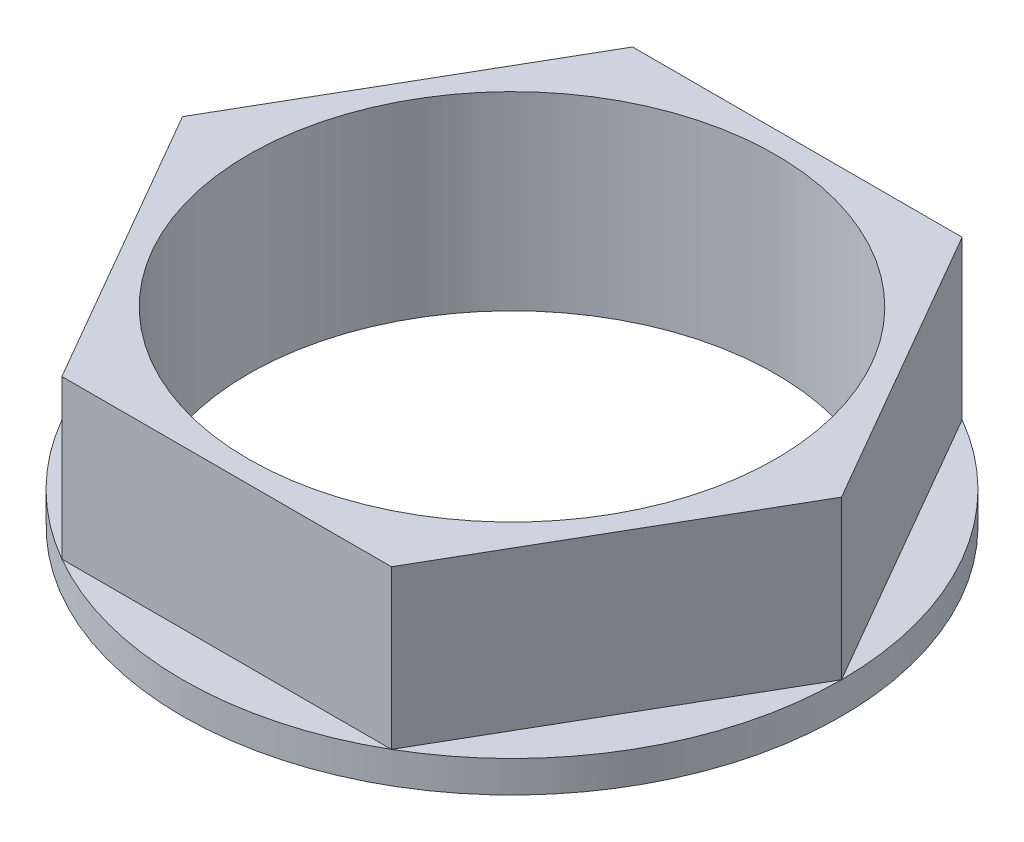
from build123d import *

# Parameters (mm, degrees)
SKETCH1_R           = 7.9375
BOSS_EXTRUDE1_DEPTH = 0.381
BOSS_EXTRUDE2_DEPTH = 3.81
SKETCH3_R           = 6.35
CUT_EXTRUDE1_DEPTH  = 13.120684655


with BuildPart() as part:
    # Sketch1 → Boss-Extrude1 (new, symmetric)
    with BuildSketch(Plane(origin=(0, 0, 0), x_dir=(1, 0, 0), z_dir=(0, 1, 0))):
        with Locations(Location((0, 0, 0), (0, 0, 90))):
            Circle(SKETCH1_R)
    extrude(amount=BOSS_EXTRUDE1_DEPTH, both=True)

    # Sketch2 → Boss-Extrude2 (add)
    with BuildSketch(Plane(origin=(0, 0.381, 0), x_dir=(1, 0, 0), z_dir=(0, 1, 0))):
        Polygon((-3.96875, -6.874076643), (3.96875, -6.874076643), (7.9375, 0), (3.96875, 6.874076643), (-3.96875, 6.874076643), (-7.9375, 0), align=None)
    extrude(amount=BOSS_EXTRUDE2_DEPTH)

    # Sketch3 → Cut-Extrude1 (cut, through all)
    with BuildSketch(Plane(origin=(0, 4.191, 0), x_dir=(1, 0, 0), z_dir=(0, 1, 0))):
        with Locations(Location((0, 0, 0), (0, 0, 270))):
            Circle(SKETCH3_R)
    extrude(amount=-CUT_EXTRUDE1_DEPTH, mode=Mode.SUBTRACT)


solid = part.part
